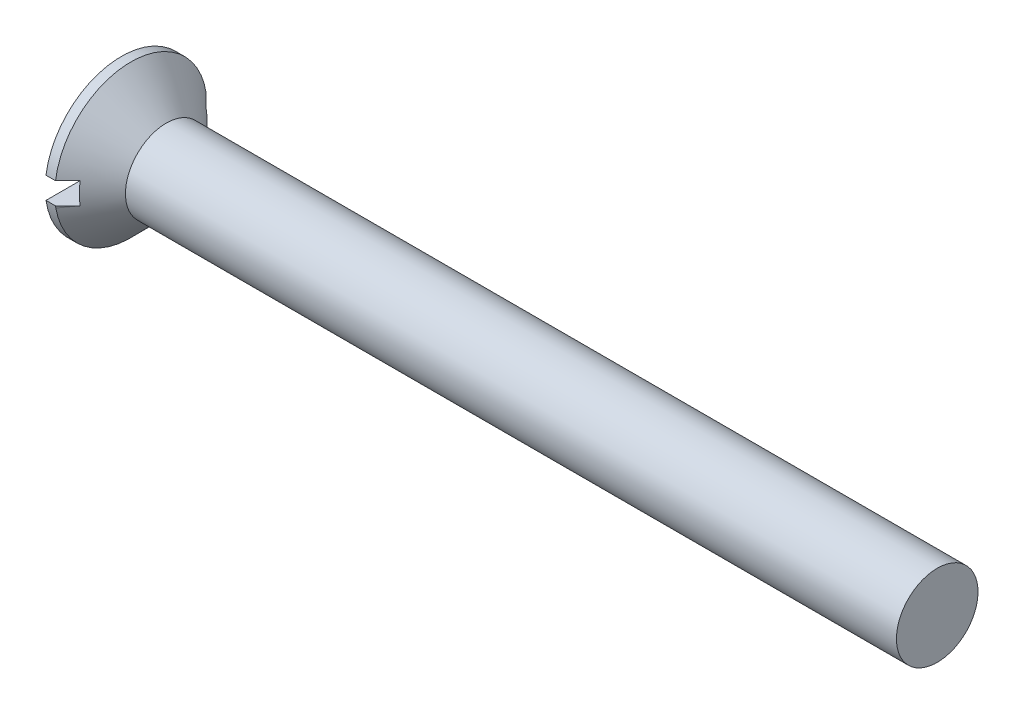
from build123d import *

# Parameters (mm, degrees)
SKETCH2_W          = 5.6
SKETCH2_H          = 0.8
CUT_EXTRUDE1_DEPTH = 0.8


with BuildPart() as part:
    # Sketch1 → Revolve1 (revolve)
    with BuildSketch(Plane.XY):
        Polygon((0, 0), (0, 2.8), (0.35, 2.8), (1.65, 1.5), (30, 1.5), (30, 0), align=None)
    revolve(axis=Axis((30, 0, 0), (-1, 0, 0)))

    # Sketch2 → Cut-Extrude1 (cut)
    with BuildSketch(Plane.ZY):
        Rectangle(SKETCH2_W, SKETCH2_H)
    extrude(amount=-CUT_EXTRUDE1_DEPTH, mode=Mode.SUBTRACT)


solid = part.part
